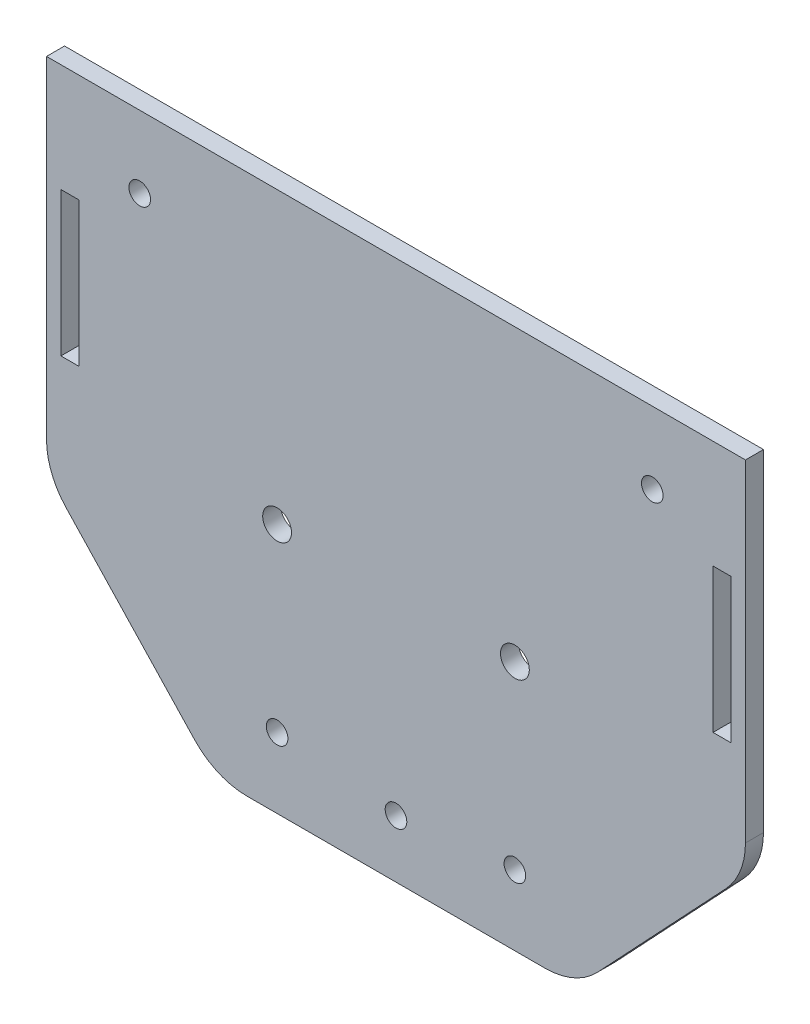
from build123d import *

# Parameters (mm, degrees)
SKETCH1_3_R         = 1.5
SKETCH1_3_R_2       = 2
SKETCH1_3_W         = 2.5
SKETCH1_3_H         = 20
BOSS_EXTRUDE2_DEPTH = 1.25
FILLET2_R           = 10


with BuildPart() as part:
    # Sketch1<3> → Boss-Extrude2 (new, symmetric)
    with BuildSketch(Plane.XY):
        Polygon((48.5, -12.5), (48.5, 37.5), (-48.5, 37.5), (-48.5, -12.5), (-25, -37.5), (25, -37.5), align=None)
        with Locations((0, -29.5)):
            Circle(SKETCH1_3_R, mode=Mode.SUBTRACT)
        with Locations((-16.5, -27.75)):
            Circle(SKETCH1_3_R, mode=Mode.SUBTRACT)
        with Locations((16.5, -27.75)):
            Circle(SKETCH1_3_R, mode=Mode.SUBTRACT)
        with Locations((16.5, -2.75)):
            Circle(SKETCH1_3_R_2, mode=Mode.SUBTRACT)
        with Locations((-45.25, 12.5)):
            Rectangle(SKETCH1_3_W, SKETCH1_3_H, mode=Mode.SUBTRACT)
        with Locations((-35.566666667, 27.5)):
            Circle(SKETCH1_3_R, mode=Mode.SUBTRACT)
        with Locations((45.25, 12.5)):
            Rectangle(SKETCH1_3_W, SKETCH1_3_H, mode=Mode.SUBTRACT)
        with Locations((35.566666667, 27.5)):
            Circle(SKETCH1_3_R, mode=Mode.SUBTRACT)
        with Locations((-16.5, -2.75)):
            Circle(SKETCH1_3_R_2, mode=Mode.SUBTRACT)
    extrude(amount=BOSS_EXTRUDE2_DEPTH, both=True)

    # Fillet2
    fillet2_edges = [part.edges().sort_by_distance(p)[0] for p in [
        (48.5, -12.5, 0),
        (25, -37.5, 0),
        (-25, -37.5, 0),
        (-48.5, -12.5, 0),
    ]]
    fillet(fillet2_edges, radius=FILLET2_R)


solid = part.part
